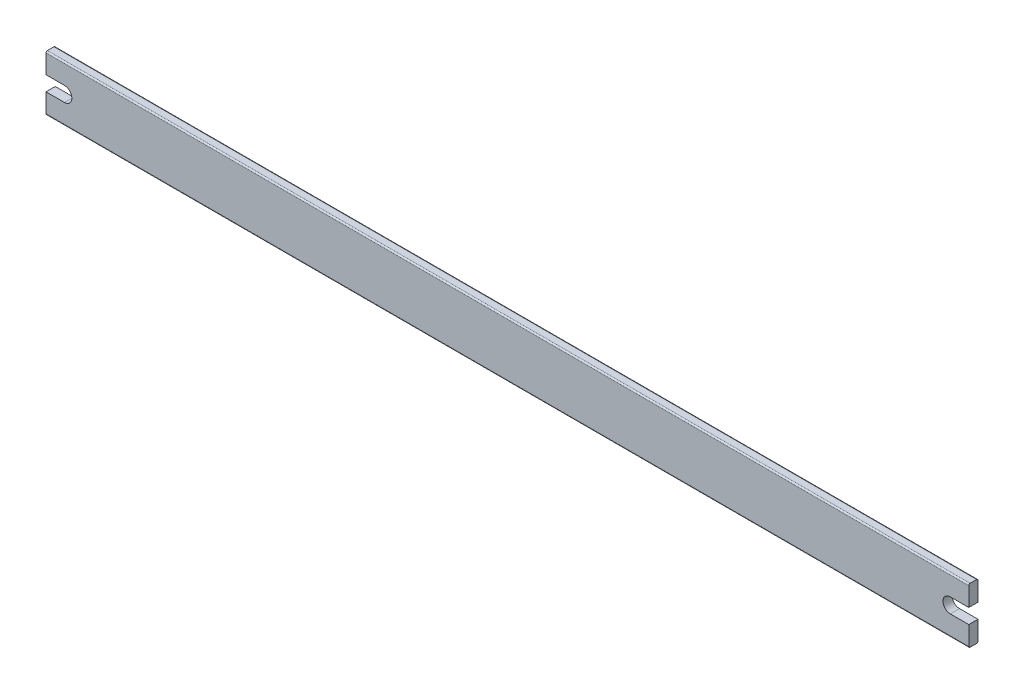
from build123d import *

# Parameters (mm, degrees)
BOSS_EXTRUDE1_DEPTH = 2.5
FILLET2_R           = 0.75


with BuildPart() as part:
    # Sketch1 → Boss-Extrude1 (new, symmetric)
    with BuildSketch(Plane.XY):
        with BuildLine():
            Line((-250, -15), (250, -15))
            Line((250, -15), (250, -4))
            Line((250, -4), (239.999999107, -4))
            ThreePointArc((239.999999107, -4), (235.999999107, 4.47e-07), (240, 4))
            Line((240, 4), (250, 4))
            Line((250, 4), (250, 15))
            Line((250, 15), (-250, 15))
            Line((-250, 15), (-250, 4))
            Line((-250, 4), (-240, 4))
            ThreePointArc((-240, 4), (-236, 0), (-240, -4))
            Line((-240, -4), (-250, -4))
            Line((-250, -4), (-250, -15))
        make_face()
    extrude(amount=BOSS_EXTRUDE1_DEPTH, both=True)

    # Fillet2
    fillet2_edges = [part.edges().sort_by_distance(p)[0] for p in [
        (0, -15, -2.5),
        (0, -15, 2.5),
        (0, 15, -2.5),
        (0, 15, 2.5),
    ]]
    fillet(fillet2_edges, radius=FILLET2_R)


solid = part.part
